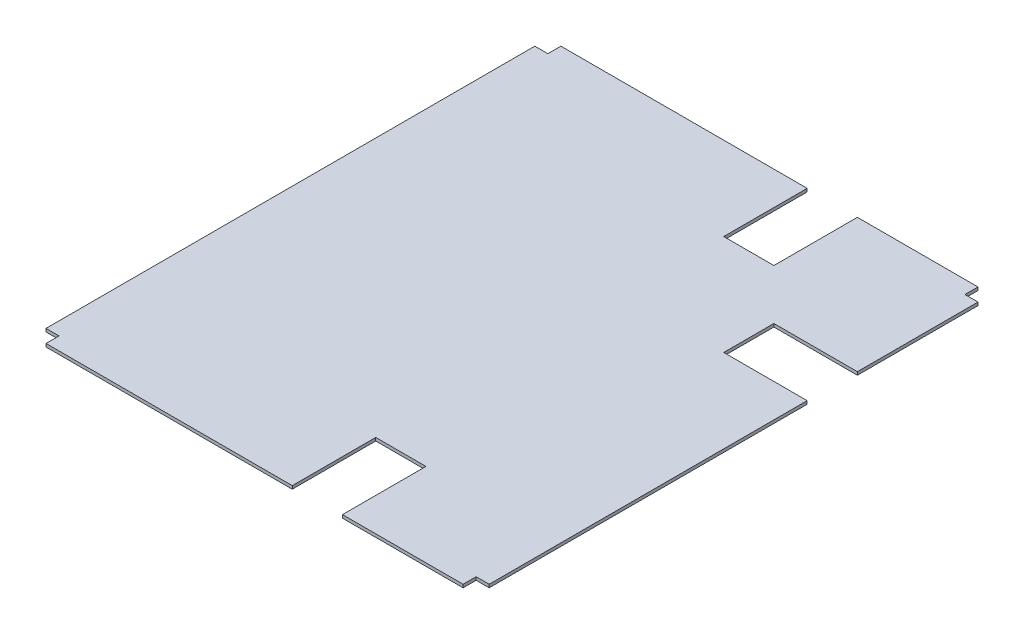
from build123d import *

# Parameters (mm, degrees)
BOSS_EXTRUDE1_DEPTH = 21.7


with BuildPart() as part:
    # Sketch1 → Boss-Extrude1 (new body)
    with BuildSketch(Plane(origin=(0, 0, 0), x_dir=(1, 0, 0), z_dir=(0, 1, 0))):
        Polygon((-200, -1795), (-516, -1795), (-1454, -1795), (-1454, -1704), (-1545, -1704), (-1545, -1), (-1545, 1213), (-1545, 1704), (-1454, 1704), (-1454, 1795), (-516, 1795), (263, 1795), (263, 1213), (516, 1213), (613, 1213), (613, 1795), (1454, 1795), (1454, 1704), (1545, 1704), (1545, 863), (963, 863), (963, 513), (1545, 513), (1545, -1), (1545, -1704), (1454, -1704), (1454, -1795), (613, -1795), (613, -1213), (514, -1213), (263, -1213), (263, -1795), align=None)
    extrude(amount=BOSS_EXTRUDE1_DEPTH)


solid = part.part
